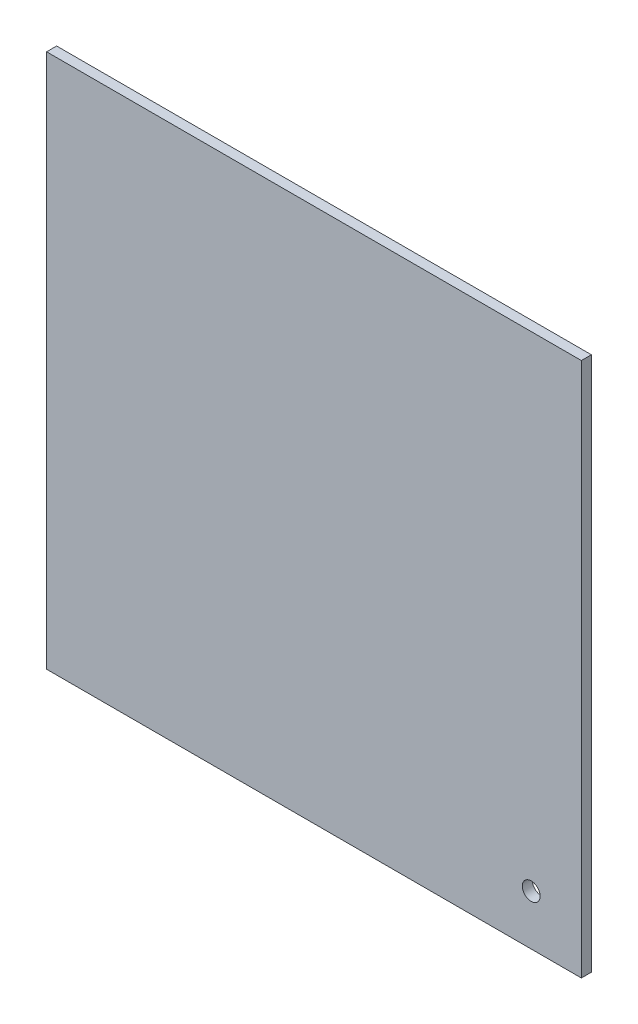
from build123d import *

# Parameters (mm, degrees)
SKETCH1_W                  = 96
SKETCH1_H                  = 96
BOSS_EXTRUDE1_DEPTH        = 1.8
F_3_2_3_2_DIAMETER_HOLE1_D = 3.2


with BuildPart() as part:
    # Sketch1 → Boss-Extrude1 (new body)
    with BuildSketch(Plane.XY):
        Rectangle(SKETCH1_W, SKETCH1_H)
    extrude(amount=BOSS_EXTRUDE1_DEPTH)

    # Ø3.2 (3.2) Diameter Hole1 (through all)
    with Locations(Plane.XY.offset(1.8)):
        with Locations((39, -39)):
            Hole(F_3_2_3_2_DIAMETER_HOLE1_D / 2)


solid = part.part
